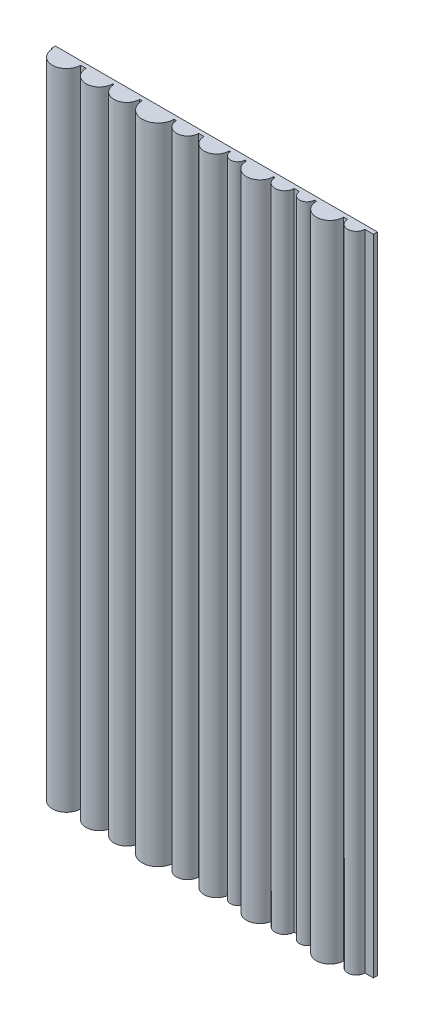
from build123d import *

# Parameters (mm, degrees)
SKETCH_1_W          = 8
SKETCH_1_H          = 16
EXTRUDE_1_DEPTH     = 0.1
SKETCH_2_R          = 0.351145055
SKETCH_2_R_2        = 0.320051596
SKETCH_2_R_3        = 0.275332799
SKETCH_2_R_4        = 0.311816498
SKETCH_2_R_5        = 0.337022537
SKETCH_2_R_6        = 0.237251683
SKETCH_2_R_7        = 0.183022727
SKETCH_2_R_8        = 0.212967473
SKETCH_2_R_9        = 0.332451038
SKETCH_2_R_10       = 0.39699232
SKETCH_2_R_11       = 0.179641096
SKETCH_2_R_12       = 0.340279333
EXTRUDE_2_DEPTH     = 16
SKETCH_3_W          = 8
SKETCH_3_H          = 0.451969464
CUT_EXTRUDE_1_DEPTH = 16


with BuildPart() as part:
    # 草图1 → 凸台-拉伸1 (new body)
    with BuildSketch(Plane.XY):
        with Locations((4, 8)):
            Rectangle(SKETCH_1_W, SKETCH_1_H)
    extrude(amount=EXTRUDE_1_DEPTH)

    # 草图2 → 凸台-拉伸2 (add)
    with BuildSketch(Plane.XZ):
        with Locations((0.375106215, 0.1)):
            Circle(SKETCH_2_R)
        with Locations((1.87485289, 0.1)):
            Circle(SKETCH_2_R_2)
        with Locations((3.383753503, 0.1)):
            Circle(SKETCH_2_R_3)
        with Locations((4.105676482, 0.1)):
            Circle(SKETCH_2_R_4)
        with Locations((5.183476985, 0.1)):
            Circle(SKETCH_2_R_5)
        with Locations((5.793552742, 0.1)):
            Circle(SKETCH_2_R_6)
        with Locations((6.346010233, 0.1)):
            Circle(SKETCH_2_R_7)
        with Locations((7.572940366, 0.1)):
            Circle(SKETCH_2_R_8)
        with Locations((1.192332615, 0.1)):
            Circle(SKETCH_2_R_9)
        with Locations((2.651662595, 0.1)):
            Circle(SKETCH_2_R_10)
        with Locations((4.627630185, 0.1)):
            Circle(SKETCH_2_R_11)
        with Locations((6.922192892, 0.1)):
            Circle(SKETCH_2_R_12)
    extrude(amount=-EXTRUDE_2_DEPTH)

    # 草图3 → 切除-拉伸1 (cut)
    with BuildSketch(Plane.XZ):
        with Locations((4, -0.225984732)):
            Rectangle(SKETCH_3_W, SKETCH_3_H)
    extrude(amount=-CUT_EXTRUDE_1_DEPTH, mode=Mode.SUBTRACT)


solid = part.part
